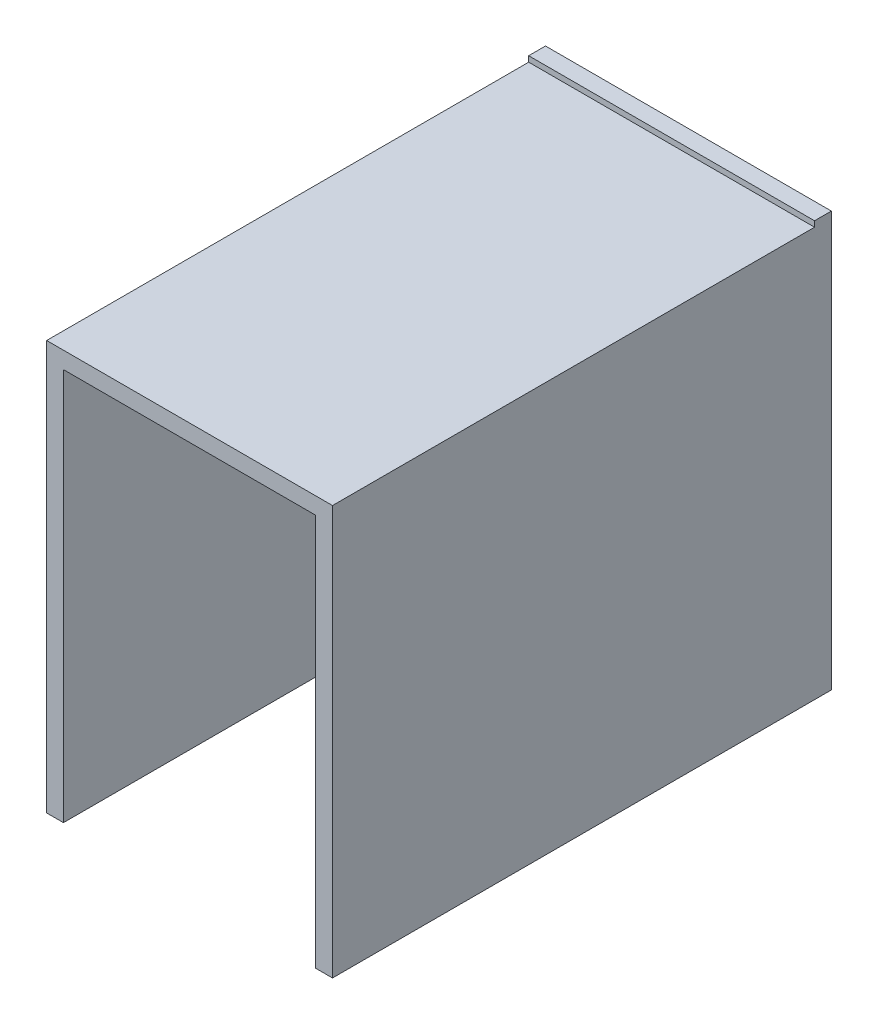
from build123d import *

# Parameters (mm, degrees)
BOSS_EXTRUDE1_DEPTH = 9
SKETCH3_W           = 22.5
SKETCH3_H           = 35
BOSS_EXTRUDE2_DEPTH = 1.5
BOSS_EXTRUDE5_DEPTH = 43
BOSS_EXTRUDE6_DEPTH = 1.5


with BuildPart() as part:
    # Sketch1 → Boss-Extrude1 (new body)
    with BuildSketch(Plane.XY):
        with BuildLine():
            Line((8, -2.872281323), (8, -14.255843504))
            Line((8, -14.255843504), (9.25, -14.255843504))
            Line((9.25, -14.255843504), (9.25, -3.491060011))
            ThreePointArc((9.25, -3.491060011), (0, 9.961709327), (-9.25, -3.491060011))
            Line((-9.25, -3.491060011), (-9.25, -14.255843504))
            Line((-9.25, -14.255843504), (-8, -14.255843504))
            Line((-8, -14.255843504), (-8, -2.872281323))
            ThreePointArc((-8, -2.872281323), (0, 8.5), (8, -2.872281323))
        make_face()
    extrude(amount=BOSS_EXTRUDE1_DEPTH)

    # Sketch3 → Boss-Extrude2 (add)
    with BuildSketch(Plane.XY):
        with Locations((0, -6.3)):
            Rectangle(SKETCH3_W, SKETCH3_H)
    extrude(amount=-BOSS_EXTRUDE2_DEPTH)



with BuildPart() as body_2:
    # Sketch9 → Boss-Extrude5 (new body)
    with BuildSketch(Plane.XY):
        Polygon((-12.75, 12.7), (12.75, 12.7), (12.75, -23.8), (11.25, -23.8), (11.25, 11.2), (-11.25, 11.2), (-11.25, -23.8), (-12.75, -23.8), align=None)
    extrude(amount=BOSS_EXTRUDE5_DEPTH)


with BuildPart() as part_1:
    add(part.part)

    add(body_2.part)  # Boss-Extrude6 merges body 2
    # Sketch10 → Boss-Extrude6 (add)
    with BuildSketch(Plane.XY):
        Polygon((-12.75, 13.2), (12.75, 13.2), (12.75, -23.8), (11.25, -23.8), (11.25, 11.2), (-11.25, 11.2), (-11.25, -23.8), (-12.75, -23.8), align=None)
    extrude(amount=-BOSS_EXTRUDE6_DEPTH)


solid = part_1.part
